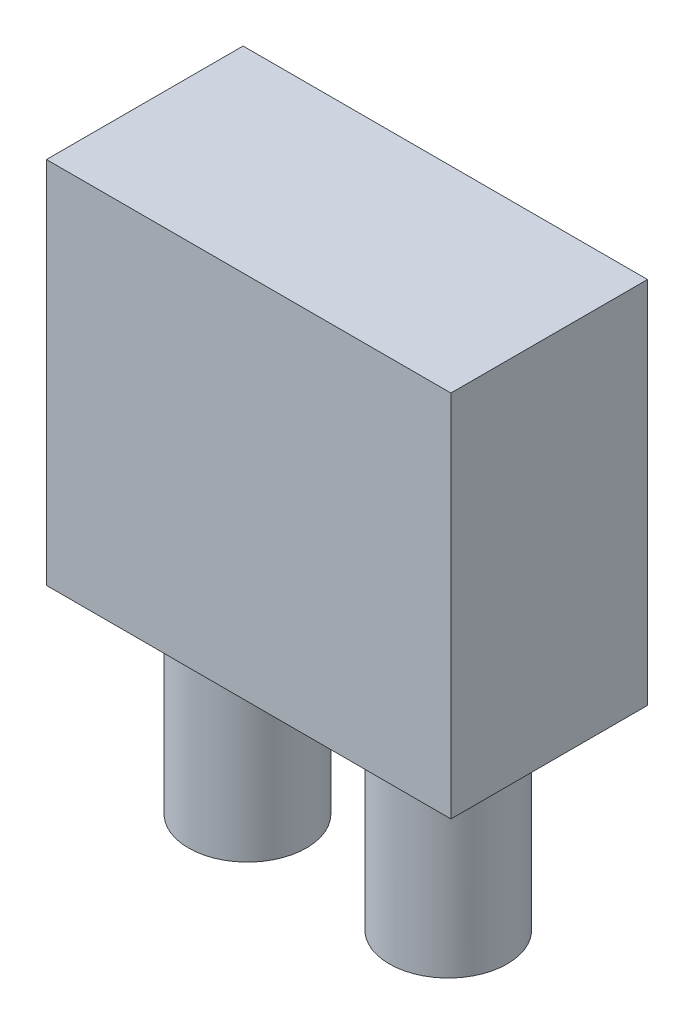
from build123d import *

# Parameters (mm, degrees)
SKETCH_1_W      = 10.284966626
SKETCH_1_H      = 9.380426844
EXTRUDE_1_DEPTH = 5
SKETCH_2_R      = 1.5
EXTRUDE_2_DEPTH = 5


with BuildPart() as part:
    # 草图1 → 凸台-拉伸1 (new body)
    with BuildSketch(Plane.XY):
        Rectangle(SKETCH_1_W, SKETCH_1_H)
    extrude(amount=EXTRUDE_1_DEPTH)

    # 草图2 → 凸台-拉伸2 (add)
    with BuildSketch(Plane.XZ.offset(4.690213422)):
        with Locations(Location((2.553176364, 2.478071855, 0), (0, 0, 90))):
            Circle(SKETCH_2_R)
        with Locations(Location((-2.553176364, 2.478071855, 0), (0, 0, 90))):
            Circle(SKETCH_2_R)
    extrude(amount=EXTRUDE_2_DEPTH)


solid = part.part
